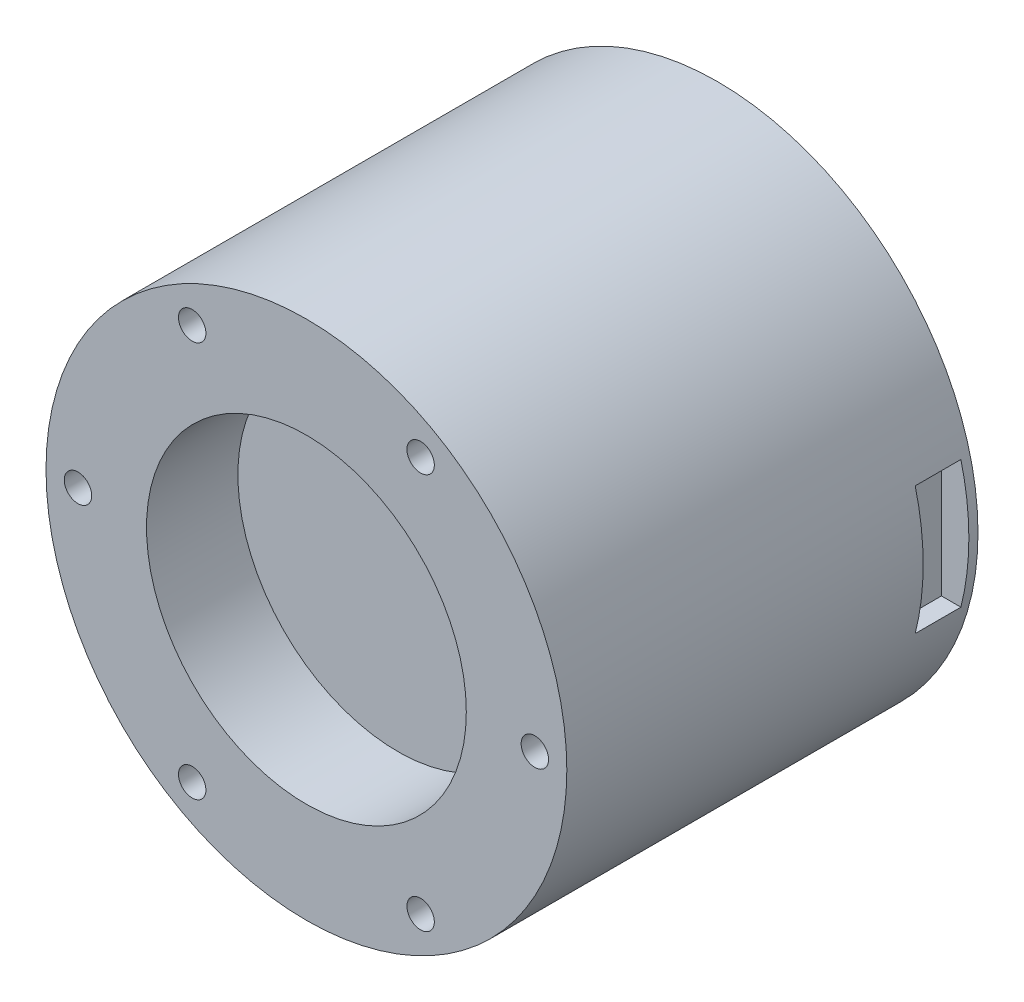
from build123d import *

# Parameters (mm, degrees)
SKETCH_1_R               = 28.5
EXTRUDE_1_DEPTH          = 45
SKETCH_2_R               = 1.5
CUT_EXTRUDE_1_DEPTH      = 5
PATTERN_CIRCULAR_1_COUNT = 6
SKETCH_3_R               = 17.5
CUT_EXTRUDE_2_DEPTH      = 10
CUT_EXTRUDE_START        = -1
CUT_EXTRUDE_3_DEPTH      = 5
CUT_EXTRUDE_4_DEPTH      = 8
SKETCH_6_R               = 1.5
CUT_EXTRUDE_5_DEPTH      = 4
PATTERN_CIRCULAR_2_COUNT = 4


with BuildPart() as part:
    # 草图1 → 凸台-拉伸1 (new body)
    with BuildSketch(Plane.XY):
        with Locations(Location((0, 0, 0), (0, 0, 180))):
            Circle(SKETCH_1_R)
    extrude(amount=EXTRUDE_1_DEPTH)

    # 草图2 → 切除-拉伸1 (cut)
    with BuildSketch(Plane.XY.offset(45)):
        with Locations((25, 0)):
            Circle(SKETCH_2_R)
    cut_extrude_1 = extrude(amount=-CUT_EXTRUDE_1_DEPTH, mode=Mode.SUBTRACT)

    # 阵列(圆周)1: 切除-拉伸1 ×6 about axis
    pattern_circular_1_axis = Axis((0, 0, 0), (0, 0, 1))
    for i in range(1, PATTERN_CIRCULAR_1_COUNT):
        add(cut_extrude_1.rotate(pattern_circular_1_axis, i * 360 / PATTERN_CIRCULAR_1_COUNT), mode=Mode.SUBTRACT)

    # 草图3 → 切除-拉伸2 (cut)
    with BuildSketch(Plane.XY.offset(45)):
        Circle(SKETCH_3_R)
    extrude(amount=-CUT_EXTRUDE_2_DEPTH, mode=Mode.SUBTRACT)

    # 草图4 → 切除-拉伸3 (cut)
    with BuildSketch(Plane(origin=(0, 0, 0), x_dir=(-1, 0, 0), z_dir=(0, 0, -1)).offset(CUT_EXTRUDE_START)):
        with BuildLine():
            Line((-25.5, -7), (-27.689719766, -7))
            ThreePointArc((-27.689719766, -7), (-28.56082248, 0), (-27.689719766, 7))
            Line((-27.689719766, 7), (-25.5, 7))
            Line((-25.5, 7), (-25.5, -7))
        make_face()
        with BuildLine():
            Line((25.5, 7), (27.689719766, 7))
            ThreePointArc((27.689719766, 7), (28.56082248, 0), (27.689719766, -7))
            Line((27.689719766, -7), (25.5, -7))
            Line((25.5, -7), (25.5, 7))
        make_face()
    extrude(amount=-CUT_EXTRUDE_3_DEPTH, mode=Mode.SUBTRACT)

    # 草图5 → 切除-拉伸4 (cut)
    with BuildSketch(Plane(origin=(0, 0, 0), x_dir=(-1, 0, 0), z_dir=(0, 0, -1)).offset(CUT_EXTRUDE_START)):
        with BuildLine():
            Line((-4, -25.5), (4, -25.5))
            Line((4, -25.5), (4, -28.217902119))
            ThreePointArc((4, -28.217902119), (0, -28.5), (-4, -28.217902119))
            Line((-4, -28.217902119), (-4, -25.5))
        make_face()
    extrude(amount=-CUT_EXTRUDE_4_DEPTH, mode=Mode.SUBTRACT)

    # 草图6 → 切除-拉伸5 (cut)
    with BuildSketch(Plane(origin=(0, 0, 0), x_dir=(-1, 0, 0), z_dir=(0, 0, -1))):
        with Locations((13.435028843, 13.435028843)):
            Circle(SKETCH_6_R)
    cut_extrude_5 = extrude(amount=-CUT_EXTRUDE_5_DEPTH, mode=Mode.SUBTRACT)

    # 阵列(圆周)2: 切除-拉伸5 ×4 about axis
    pattern_circular_2_axis = Axis((0, 0, 0), (0, 0, 1))
    for i in range(1, PATTERN_CIRCULAR_2_COUNT):
        add(cut_extrude_5.rotate(pattern_circular_2_axis, i * 360 / PATTERN_CIRCULAR_2_COUNT), mode=Mode.SUBTRACT)


solid = part.part
